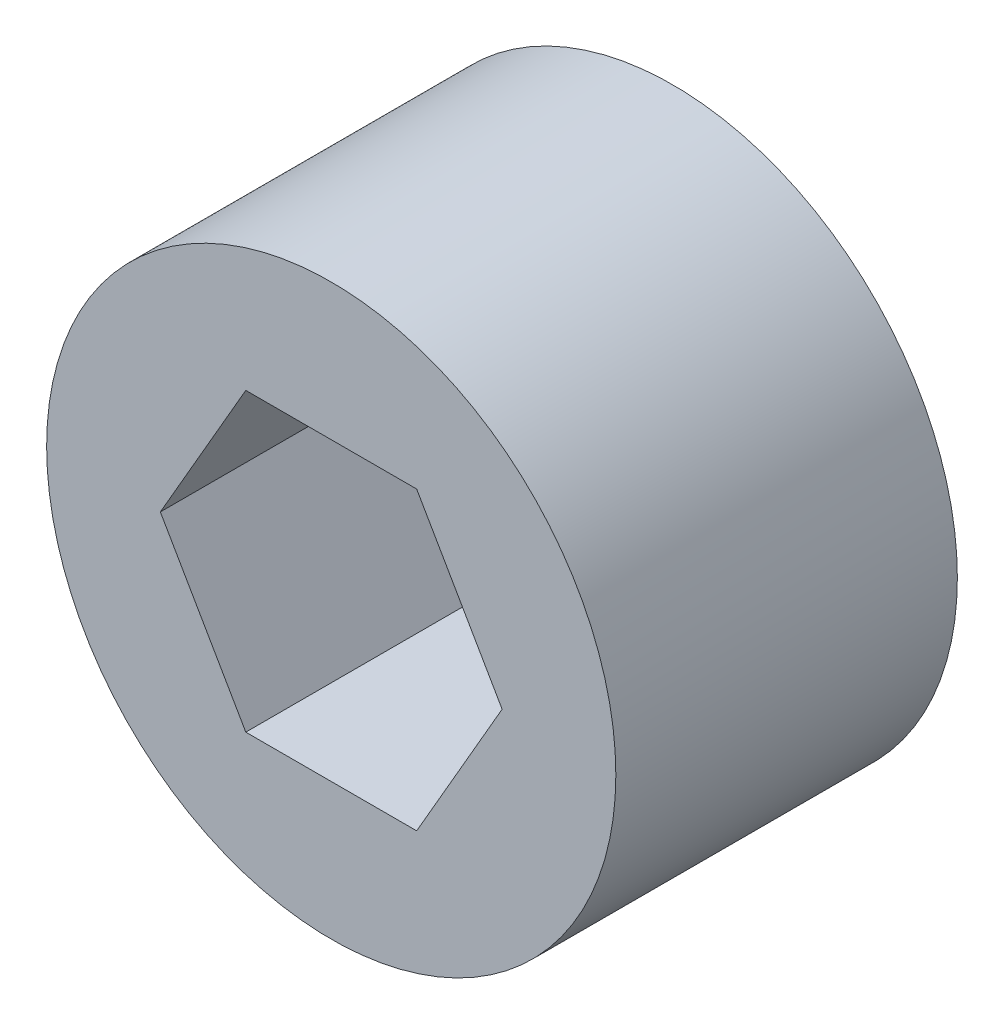
from build123d import *

# Parameters (mm, degrees)
SKETCH1_R           = 12.7
BOSS_EXTRUDE1_DEPTH = 15.24


with BuildPart() as part:
    # Sketch1 → Boss-Extrude1 (new body)
    with BuildSketch(Plane.XY):
        with Locations(Location((0, 0, 0), (0, 0, 180))):
            Circle(SKETCH1_R)
        Polygon((3.812821178, -6.604), (7.625642355, 0), (3.812821178, 6.604), (-3.812821178, 6.604), (-7.625642355, 0), (-3.812821178, -6.604), align=None, mode=Mode.SUBTRACT)
    extrude(amount=BOSS_EXTRUDE1_DEPTH)


solid = part.part
